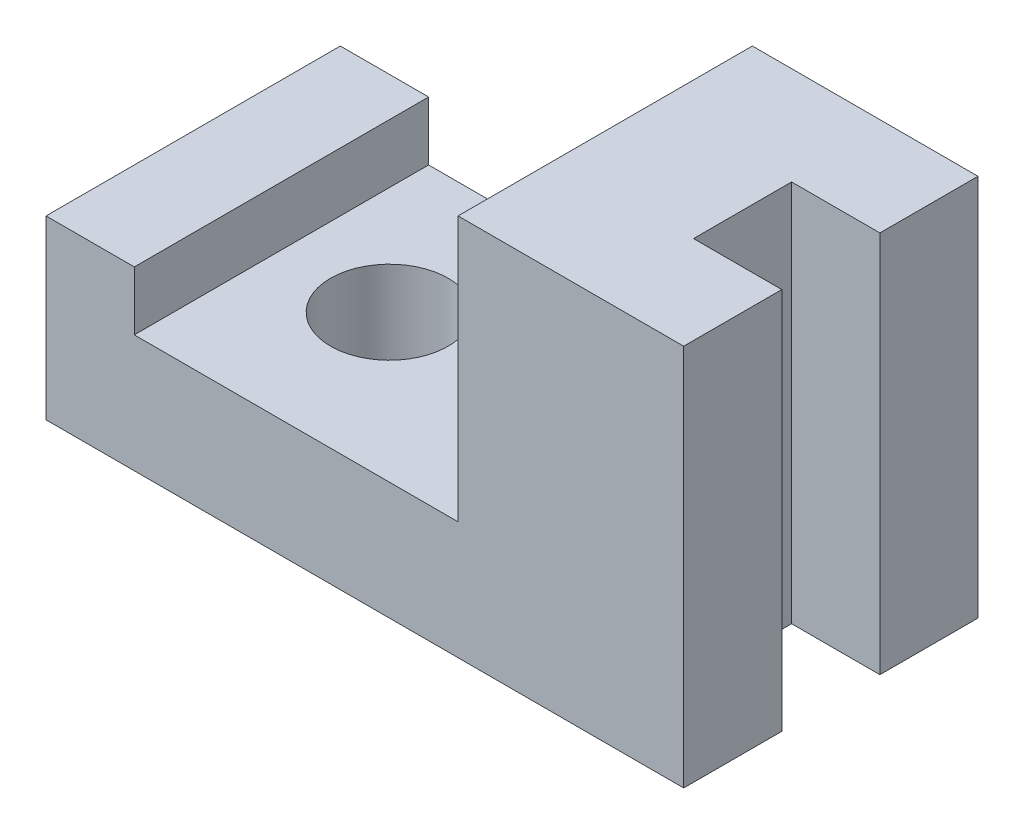
from build123d import *

# Parameters (mm, degrees)
SKETCH1_W               = 65
SKETCH1_H               = 39
BOSS_EXTRUDE2_DEPTH     = 15
SKETCH3_W               = 10
SKETCH3_H               = 39
CUT_EXTRUDE1_DEPTH      = 9
CUT_EXTRUDE2_DEPTH      = 82.523002889
CUT_EXTRUDE2_DEPTH_BACK = 82.523002889
CUT_EXTRUDE3_DEPTH      = 72.965269401
CUT_EXTRUDE3_DEPTH_BACK = 72.965269401
SKETCH6_R               = 6


with BuildPart() as part:
    # Sketch1 → Boss-Extrude2 (new, symmetric)
    with BuildSketch(Plane.XY):
        with Locations((32.5, 19.5)):
            Rectangle(SKETCH1_W, SKETCH1_H)
    extrude(amount=BOSS_EXTRUDE2_DEPTH, both=True)

    # Sketch3 → Cut-Extrude1 (cut)
    with BuildSketch(Plane(origin=(65, 0, 0), x_dir=(0, 0, -1), z_dir=(1, 0, 0))):
        with Locations((0, 19.5)):
            Rectangle(SKETCH3_W, SKETCH3_H)
    extrude(amount=-CUT_EXTRUDE1_DEPTH, mode=Mode.SUBTRACT)

    # Sketch5 → Cut-Extrude2 (cut, two sides: drawn at the far end of the back side and taken through both)
    with BuildSketch(Plane.XY.offset(15).offset(-CUT_EXTRUDE2_DEPTH_BACK)):
        Polygon((42, 39), (42, 12), (9, 12), (9, 18), (0, 18), (0, 39), align=None)
    extrude(amount=CUT_EXTRUDE2_DEPTH + CUT_EXTRUDE2_DEPTH_BACK, mode=Mode.SUBTRACT)

    # Sketch6 → Cut-Extrude3 (cut, two sides: drawn at the far end of the back side and taken through both)
    with BuildSketch(Plane(origin=(0, 12, 0), x_dir=(1, 0, 0), z_dir=(0, 1, 0)).offset(-CUT_EXTRUDE3_DEPTH_BACK)):
        with Locations(Location((20, 0, 0), (0, 0, 180))):
            Circle(SKETCH6_R)
    extrude(amount=CUT_EXTRUDE3_DEPTH + CUT_EXTRUDE3_DEPTH_BACK, mode=Mode.SUBTRACT)


solid = part.part
